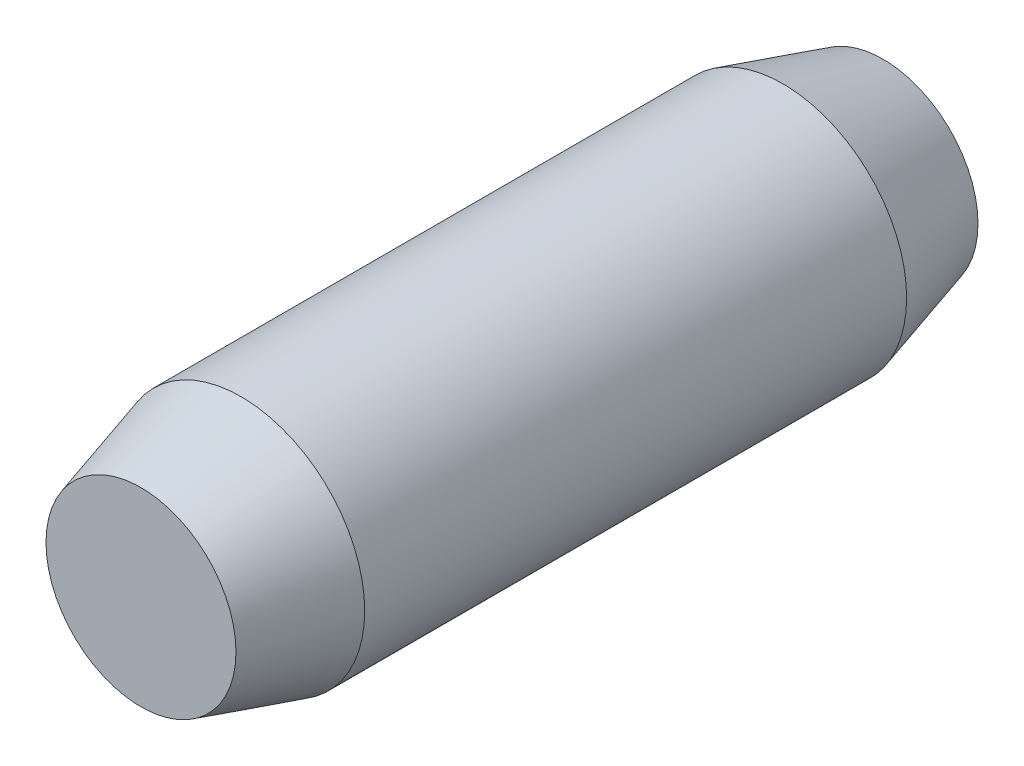
from build123d import *


with BuildPart() as part:
    # Sketch3 → Revolve1 (revolve)
    with BuildSketch(Plane(origin=(0, 0, 0), x_dir=(0, 0, -1), z_dir=(1, 0, 0)), mode=Mode.PRIVATE) as revolve1_sk:
        Polygon((-2.38125, 0), (2.38125, 0), (2.38125, 0.6096), (1.73904263, 0.79375), (-1.73904263, 0.79375), (-2.38125, 0.6096), align=None)
    revolve(revolve1_sk.sketch.rotate(Axis((0, 0, 2.38125), (0, 0, -1)), 90), axis=Axis((0, 0, 2.38125), (0, 0, -1)))


solid = part.part
